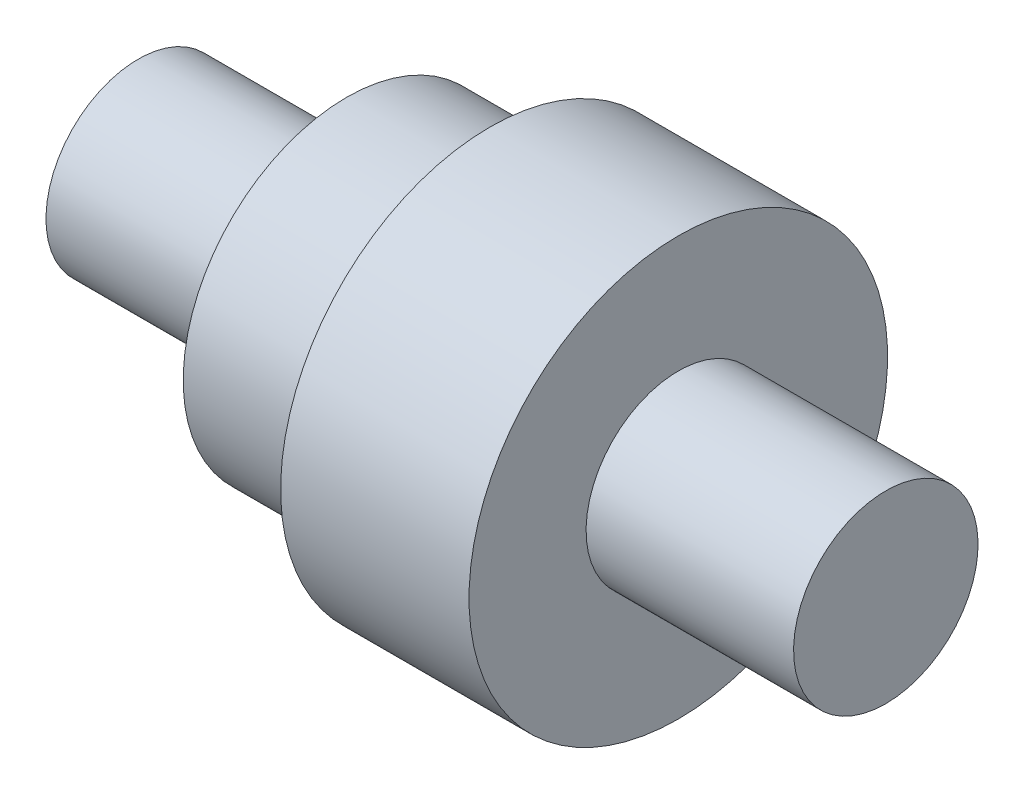
from build123d import *

# Parameters (mm, degrees)
SKETCH1_W   = 7.08
SKETCH1_H   = 3.133597909
SKETCH1_W_2 = 11.27
SKETCH1_W_3 = 7.05


with BuildPart() as part:
    # Sketch1 → Revolve1 (revolve)
    with BuildSketch(Plane.XY, mode=Mode.PRIVATE) as revolve1_sk:
        with Locations((-8.41, 1.566798955)):
            Rectangle(SKETCH1_W, SKETCH1_H)
        with Locations((0.765, 1.566798955)):
            Rectangle(SKETCH1_W_2, SKETCH1_H)
        Polygon((6.4, 7.11), (0, 7.11), (0, 5.55), (-4.87, 5.55), (-4.87, 3.133597909), (6.4, 3.133597909), align=None)
        with Locations((9.925, 1.566798955)):
            Rectangle(SKETCH1_W_3, SKETCH1_H)
    revolve(revolve1_sk.sketch.rotate(Axis((-4.87, 0, 0), (1, 0, 0)), 180), axis=Axis((-4.87, 0, 0), (1, 0, 0)))


solid = part.part
